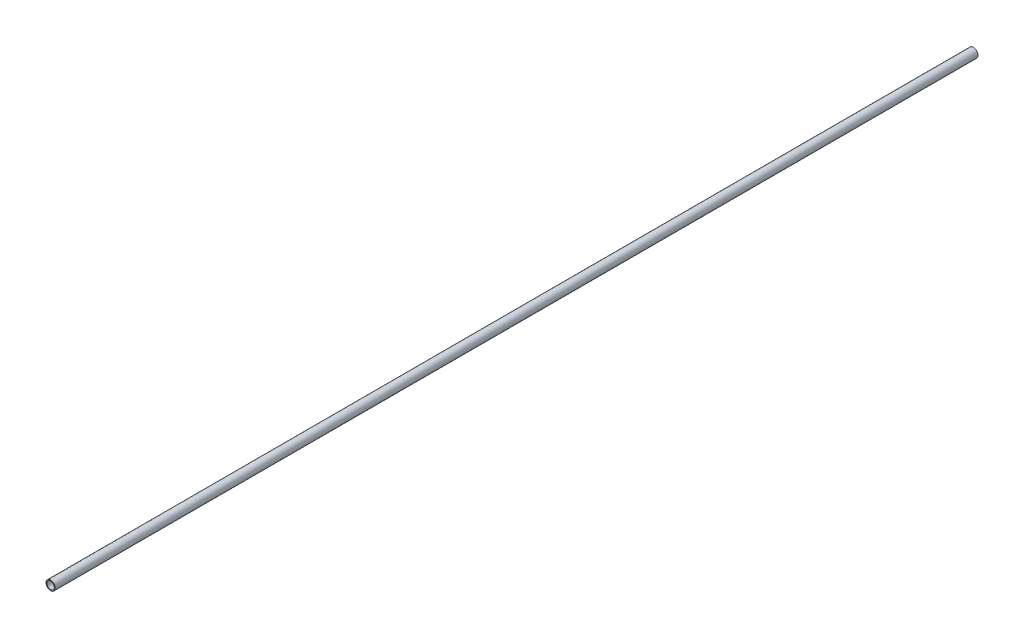
from build123d import *

# Parameters (mm, degrees)
SKETCH1_R           = 5
BOSS_EXTRUDE1_DEPTH = 500
SHELL1_T            = -1


with BuildPart() as part:
    # Sketch1 → Boss-Extrude1 (new, symmetric)
    with BuildSketch(Plane.XY):
        Circle(SKETCH1_R)
    extrude(amount=BOSS_EXTRUDE1_DEPTH, both=True)

    # Shell1
    shell1_openings = [part.faces().sort_by_distance(p)[0] for p in [
        (0, 0, 500),
        (0, 0, -500),
    ]]
    offset(amount=SHELL1_T, openings=shell1_openings, kind=Kind.INTERSECTION)


solid = part.part
